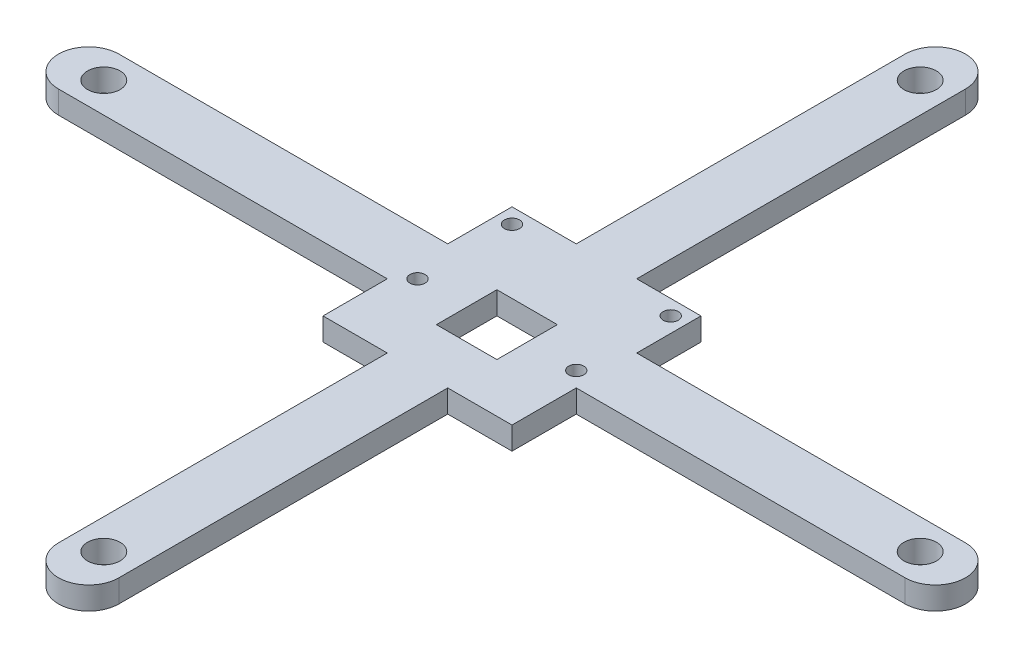
from build123d import *

# Parameters (mm, degrees)
SCHIZZO1_R                   = 1
SCHIZZO1_R_2                 = 2.15
SCHIZZO1_W                   = 8
SCHIZZO1_H                   = 8
ESTRUSIONE_ESTRUSIONE1_DEPTH = 3


with BuildPart() as part:
    # Schizzo1 → Estrusione-Estrusione1 (new body)
    with BuildSketch(Plane(origin=(0, 0, 0), x_dir=(1, 0, 0), z_dir=(0, 1, 0))):
        with BuildLine():
            Line((4, 55.99875276), (4, 12.5))
            Line((4, 12.5), (12.5, 12.5))
            Line((12.5, 12.5), (12.5, 4))
            Line((12.5, 4), (55.99875276, 4))
            ThreePointArc((55.99875276, 4), (60, 0), (55.99875276, -4))
            Line((55.99875276, -4), (12.5, -4))
            Line((12.5, -4), (12.5, -12.5))
            Line((12.5, -12.5), (4, -12.5))
            Line((4, -12.5), (4, -55.99875276))
            ThreePointArc((4, -55.99875276), (0, -59.99875276), (-4, -55.99875276))
            Line((-4, -55.99875276), (-4, -12.5))
            Line((-4, -12.5), (-12.5, -12.5))
            Line((-12.5, -12.5), (-12.5, -4))
            Line((-12.5, -4), (-55.99875276, -4))
            ThreePointArc((-55.99875276, -4), (-60.000000389, 0), (-55.99875276, 4))
            Line((-55.99875276, 4), (-12.5, 4))
            Line((-12.5, 4), (-12.5, 12.5))
            Line((-12.5, 12.5), (-4, 12.5))
            Line((-4, 12.5), (-4, 55.99875276))
            ThreePointArc((-4, 55.99875276), (0, 60), (4, 55.99875276))
        make_face()
        with Locations(Location((-10.5, 10.5, 0), (0, 0, 270))):
            Circle(SCHIZZO1_R, mode=Mode.SUBTRACT)
        with Locations(Location((10.5, 10.5, 0), (0, 0, 270))):
            Circle(SCHIZZO1_R, mode=Mode.SUBTRACT)
        with Locations(Location((-10.5, -2, 0), (0, 0, 270))):
            Circle(SCHIZZO1_R, mode=Mode.SUBTRACT)
        with Locations(Location((10.5, -2, 0), (0, 0, 270))):
            Circle(SCHIZZO1_R, mode=Mode.SUBTRACT)
        with Locations(Location((-54, 0, 0), (0, 0, 270))):
            Circle(SCHIZZO1_R_2, mode=Mode.SUBTRACT)
        with Locations(Location((0, 54, 0), (0, 0, 270))):
            Circle(SCHIZZO1_R_2, mode=Mode.SUBTRACT)
        with Locations(Location((54, 0, 0), (0, 0, 270))):
            Circle(SCHIZZO1_R_2, mode=Mode.SUBTRACT)
        with Locations(Location((0, -54, 0), (0, 0, 270))):
            Circle(SCHIZZO1_R_2, mode=Mode.SUBTRACT)
        with Locations((0, -2)):
            Rectangle(SCHIZZO1_W, SCHIZZO1_H, mode=Mode.SUBTRACT)
    extrude(amount=ESTRUSIONE_ESTRUSIONE1_DEPTH)


solid = part.part
